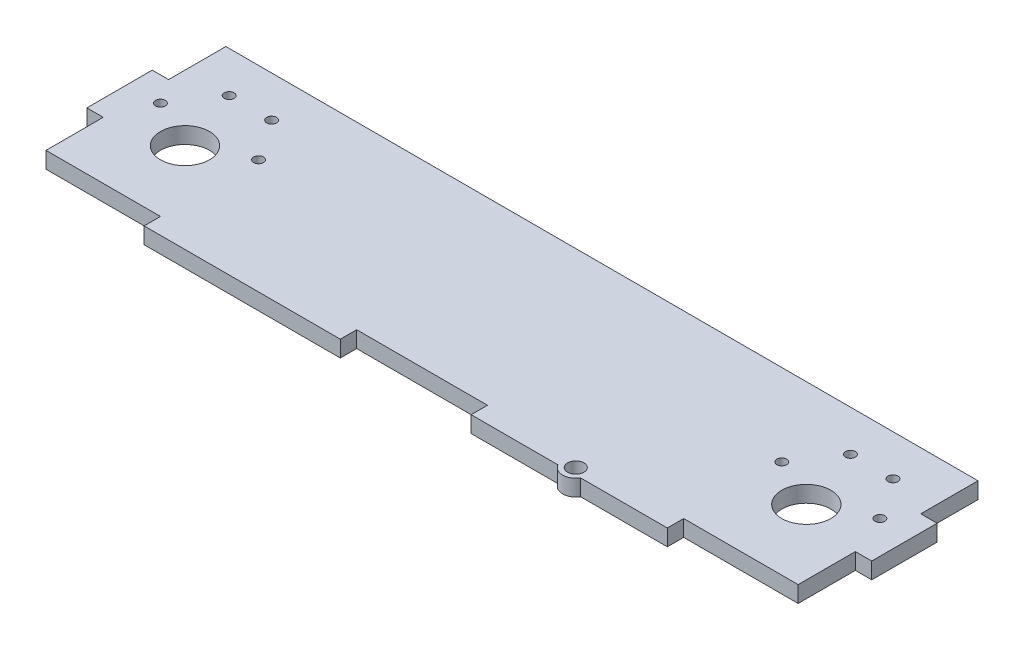
from build123d import *

# Parameters (mm, degrees)
ESQUISSE2_R        = 2.5
ESQUISSE2_R_2      = 7.5
ESQUISSE2_R_3      = 1.5
BOSS_EXTRU_5_DEPTH = 5


with BuildPart() as part:
    # Esquisse2 → Boss.-Extru.5 (new body)
    with BuildSketch(Plane(origin=(0, 0, 0), x_dir=(1, 0, 0), z_dir=(0, 1, 0))):
        with BuildLine():
            Line((-75.214465703, -26.391441925), (-75.214465703, -31.391441925))
            Line((-75.214465703, -31.391441925), (-15.214465703, -31.391441925))
            Line((-15.214465703, -31.391441925), (-15.214465703, -26.391441925))
            Line((-15.214465703, -26.391441925), (24.785534297, -26.391441925))
            Line((24.785534297, -26.391441925), (24.785534297, -31.391441925))
            Line((24.785534297, -31.391441925), (51.321432682, -31.391441925))
            ThreePointArc((51.321432682, -31.391441925), (54.785534297, -33.391441925), (58.249635912, -31.391441925))
            Line((58.249635912, -31.391441925), (84.785534297, -31.391441925))
            Line((84.785534297, -31.391441925), (84.785534297, -26.391441925))
            Line((84.785534297, -26.391441925), (119.785534297, -26.391441925))
            Line((119.785534297, -26.391441925), (119.785534297, -8.891441925))
            Line((119.785534297, -8.891441925), (124.785534297, -8.891441925))
            Line((124.785534297, -8.891441925), (124.785534297, 11.108558075))
            Line((124.785534297, 11.108558075), (119.785534297, 11.108558075))
            Line((119.785534297, 11.108558075), (119.785534297, 28.608558075))
            Line((119.785534297, 28.608558075), (-110.214465703, 28.608558075))
            Line((-110.214465703, 28.608558075), (-110.214465703, 11.108558075))
            Line((-110.214465703, 11.108558075), (-115.214465703, 11.108558075))
            Line((-115.214465703, 11.108558075), (-115.214465703, -8.891441925))
            Line((-115.214465703, -8.891441925), (-110.214465703, -8.891441925))
            Line((-110.214465703, -8.891441925), (-110.214465703, -26.391441925))
            Line((-110.214465703, -26.391441925), (-75.214465703, -26.391441925))
        make_face()
        with Locations(Location((54.785534297, -29.391441925, 0), (0, 0, 270))):
            Circle(ESQUISSE2_R, mode=Mode.SUBTRACT)
        with Locations(Location((-90.214465703, -3.891441925, 0), (0, 0, 270))):
            Circle(ESQUISSE2_R_2, mode=Mode.SUBTRACT)
        with Locations(Location((99.785534297, -3.891441925, 0), (0, 0, 270))):
            Circle(ESQUISSE2_R_2, mode=Mode.SUBTRACT)
        with Locations(Location((-105.214465703, 3.608558075, 0), (0, 0, 270))):
            Circle(ESQUISSE2_R_3, mode=Mode.SUBTRACT)
        with Locations(Location((-75.214465703, 3.608558075, 0), (0, 0, 270))):
            Circle(ESQUISSE2_R_3, mode=Mode.SUBTRACT)
        with Locations(Location((-96.714465703, 16.108558075, 0), (0, 0, 270))):
            Circle(ESQUISSE2_R_3, mode=Mode.SUBTRACT)
        with Locations(Location((-83.714465703, 16.108558075, 0), (0, 0, 270))):
            Circle(ESQUISSE2_R_3, mode=Mode.SUBTRACT)
        with Locations(Location((84.785534297, 3.608558075, 0), (0, 0, 270))):
            Circle(ESQUISSE2_R_3, mode=Mode.SUBTRACT)
        with Locations(Location((114.785534297, 3.608558075, 0), (0, 0, 270))):
            Circle(ESQUISSE2_R_3, mode=Mode.SUBTRACT)
        with Locations(Location((93.285534297, 16.108558075, 0), (0, 0, 270))):
            Circle(ESQUISSE2_R_3, mode=Mode.SUBTRACT)
        with Locations(Location((106.285534297, 16.108558075, 0), (0, 0, 270))):
            Circle(ESQUISSE2_R_3, mode=Mode.SUBTRACT)
    extrude(amount=BOSS_EXTRU_5_DEPTH)


solid = part.part
